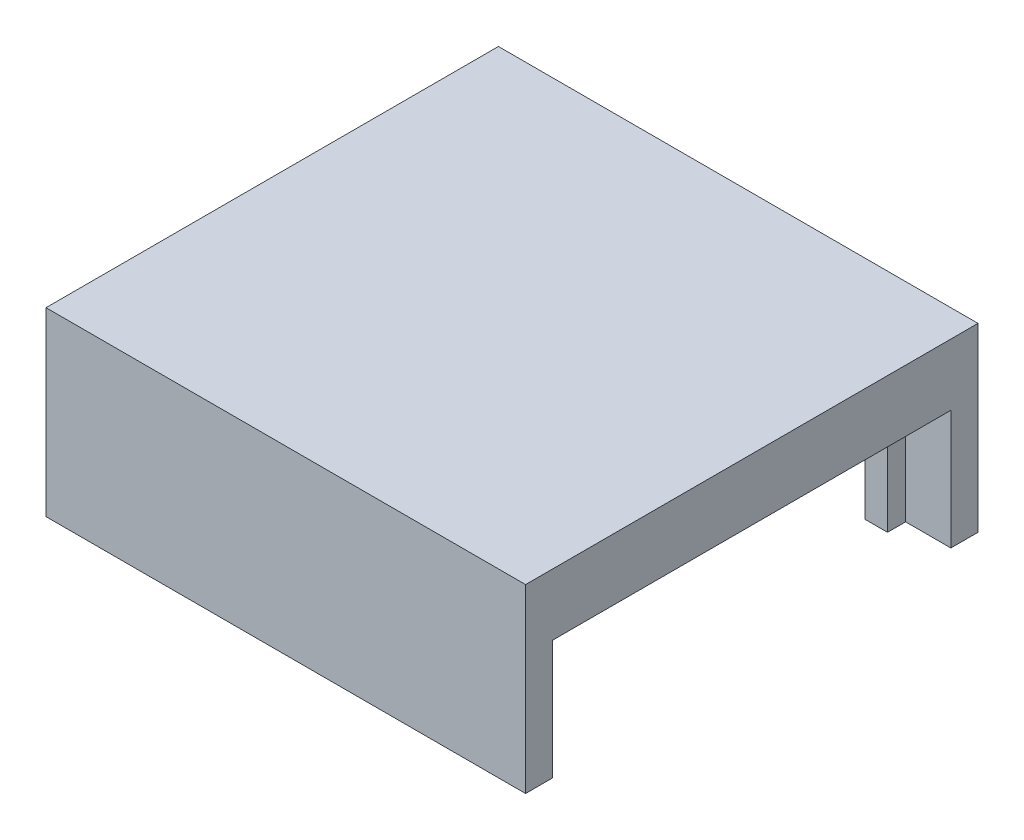
from build123d import *

# Parameters (mm, degrees)
SKETCH1_W               = 106
SKETCH1_H               = 100
BOSS_EXTRUDE1_DEPTH     = 40
SKETCH2_W               = 86
SKETCH2_H               = 80
CUT_EXTRUDE1_DEPTH      = 35
CUT_EXTRUDE2_DEPTH      = 124.838604643
CUT_EXTRUDE2_DEPTH_BACK = 10
SKETCH3_W               = 88
SKETCH3_H               = 26.357936409
SKETCH4_W               = 90
SKETCH4_H               = 33.597569481
CUT_EXTRUDE3_DEPTH      = 10
SKETCH5_W               = 76
SKETCH5_H               = 20.50870907
CUT_EXTRUDE4_DEPTH      = 10


with BuildPart() as part:
    # Sketch1 → Boss-Extrude1 (new body)
    with BuildSketch(Plane(origin=(0, 0, 0), x_dir=(1, 0, 0), z_dir=(0, 1, 0))):
        Rectangle(SKETCH1_W, SKETCH1_H)
    extrude(amount=BOSS_EXTRUDE1_DEPTH)

    # Sketch2 → Cut-Extrude1 (cut)
    with BuildSketch(Plane.XZ):
        Rectangle(SKETCH2_W, SKETCH2_H)
    extrude(amount=-CUT_EXTRUDE1_DEPTH, mode=Mode.SUBTRACT)

    # Sketch3 → Cut-Extrude2 (cut, two sides: drawn at the far end of the back side and taken through both)
    with BuildSketch(Plane(origin=(53, 0, 0), x_dir=(0, 0, -1), z_dir=(1, 0, 0)).offset(-CUT_EXTRUDE2_DEPTH_BACK)):
        with Locations((0, 13.178968205)):
            Rectangle(SKETCH3_W, SKETCH3_H)
    extrude(amount=CUT_EXTRUDE2_DEPTH + CUT_EXTRUDE2_DEPTH_BACK, mode=Mode.SUBTRACT)

    # Sketch4 → Cut-Extrude3 (cut)
    with BuildSketch(Plane.ZY.offset(53)):
        with Locations((0, 16.798784741)):
            Rectangle(SKETCH4_W, SKETCH4_H)
    extrude(amount=-CUT_EXTRUDE3_DEPTH, mode=Mode.SUBTRACT)

    # Sketch5 → Cut-Extrude4 (cut)
    with BuildSketch(Plane(origin=(0, 0, -50), x_dir=(-1, 0, 0), z_dir=(0, 0, -1))):
        with Locations((0, 10.254354535)):
            Rectangle(SKETCH5_W, SKETCH5_H)
    extrude(amount=-CUT_EXTRUDE4_DEPTH, mode=Mode.SUBTRACT)


solid = part.part
